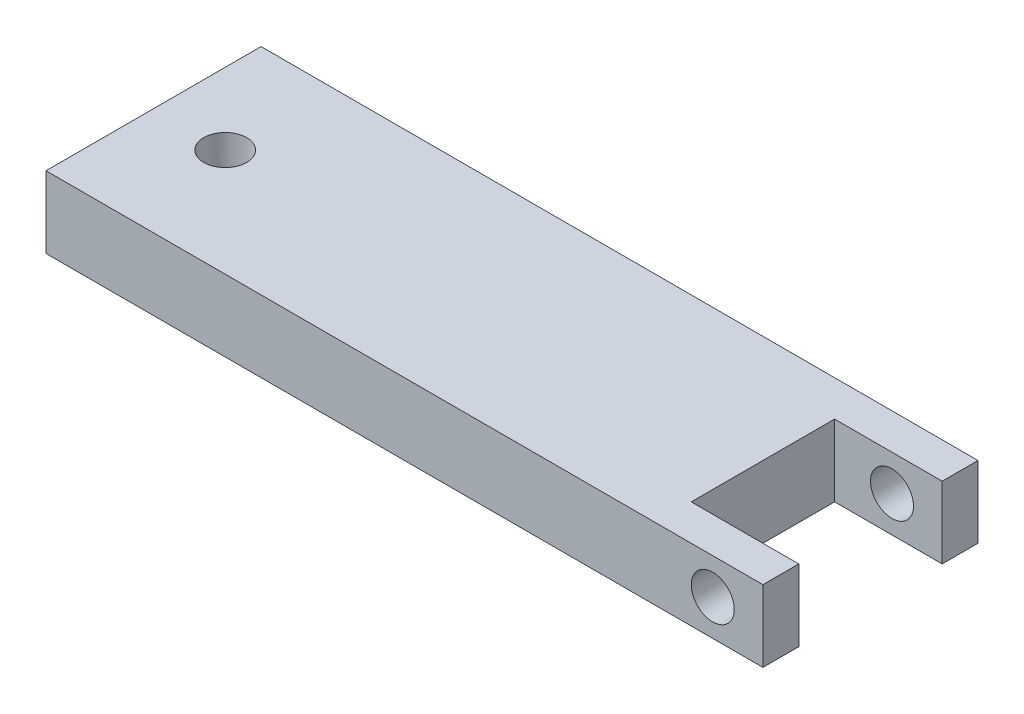
from build123d import *

# Parameters (mm, degrees)
SKETCH1_W               = 50
SKETCH1_H               = 15
BOSS_EXTRUDE1_DEPTH     = 5
CUT_EXTRUDE1_DEPTH      = 53.440442409
CUT_EXTRUDE1_DEPTH_BACK = 53.440442409
SKETCH2_R               = 1.5
SKETCH3_W               = 10
SKETCH3_H               = 5
CUT_EXTRUDE2_DEPTH      = 7.5
CUT_EXTRUDE3_DEPTH      = 53.440442409
CUT_EXTRUDE3_DEPTH_BACK = 53.440442409
SKETCH4_R               = 1.5


with BuildPart() as part:
    # Sketch1 → Boss-Extrude1 (new body)
    with BuildSketch(Plane(origin=(0, 0, 0), x_dir=(1, 0, 0), z_dir=(0, 1, 0))):
        with Locations((25, 7.5)):
            Rectangle(SKETCH1_W, SKETCH1_H)
    extrude(amount=BOSS_EXTRUDE1_DEPTH)

    # Sketch2 → Cut-Extrude1 (cut, two sides: drawn at the far end of the back side and taken through both)
    with BuildSketch(Plane(origin=(0, 5, 0), x_dir=(1, 0, 0), z_dir=(0, 1, 0)).offset(-CUT_EXTRUDE1_DEPTH_BACK)):
        with Locations(Location((5, 7.5, 0), (0, 0, 270))):
            Circle(SKETCH2_R)
    extrude(amount=CUT_EXTRUDE1_DEPTH + CUT_EXTRUDE1_DEPTH_BACK, mode=Mode.SUBTRACT)

    # Sketch3 → Cut-Extrude2 (cut)
    with BuildSketch(Plane(origin=(50, 0, 0), x_dir=(0, 0, -1), z_dir=(1, 0, 0))):
        with Locations((7.5, 2.5)):
            Rectangle(SKETCH3_W, SKETCH3_H)
    extrude(amount=-CUT_EXTRUDE2_DEPTH, mode=Mode.SUBTRACT)

    # Sketch4 → Cut-Extrude3 (cut, two sides: drawn at the far end of the back side and taken through both)
    with BuildSketch(Plane(origin=(0, 0, -15), x_dir=(-1, 0, 0), z_dir=(0, 0, -1)).offset(-CUT_EXTRUDE3_DEPTH_BACK)):
        with Locations(Location((-46.5, 2.5, 0), (0, 0, 90))):
            Circle(SKETCH4_R)
    extrude(amount=CUT_EXTRUDE3_DEPTH + CUT_EXTRUDE3_DEPTH_BACK, mode=Mode.SUBTRACT)


solid = part.part
